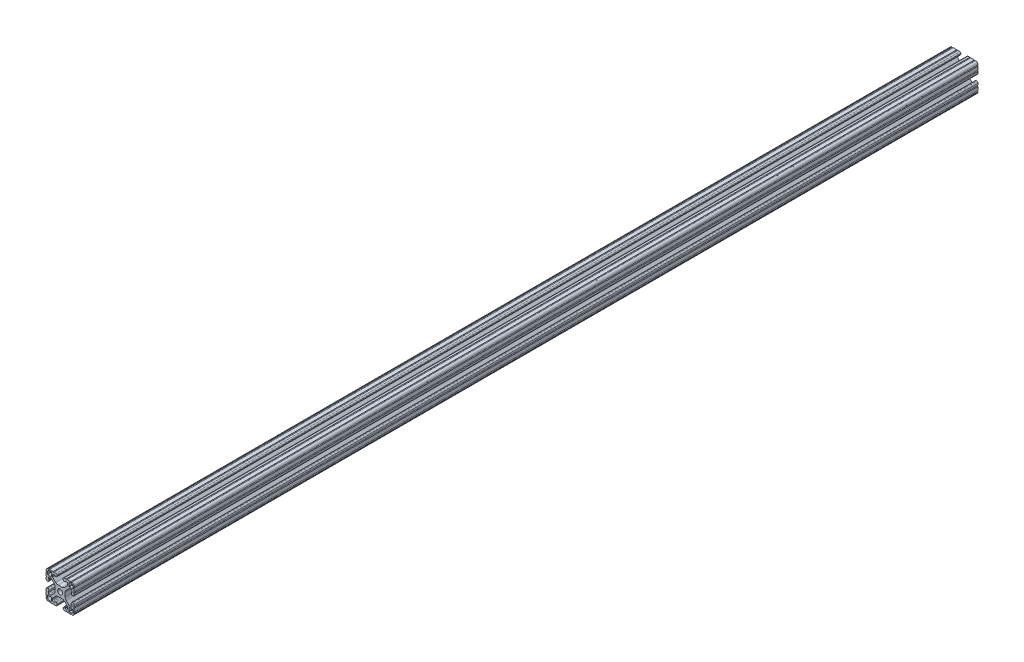
from build123d import *

# Parameters (mm, degrees)
SKETCH1_R           = 3.3274
BOSS_EXTRUDE1_DEPTH = 609.6


with BuildPart() as part:
    # Sketch1 → Boss-Extrude1 (new, symmetric)
    with BuildSketch(Plane.XY):
        with BuildLine():
            Line((-10.02670034, 12.151875049), (-6.021451835, 8.147301292))
            ThreePointArc((-6.021451835, 8.147301292), (-4.48060392, 7.11788044), (-2.663118988, 6.7564))
            Line((-2.663118988, 6.7564), (2.663118988, 6.7564))
            ThreePointArc((2.663118988, 6.7564), (4.48060392, 7.11788044), (6.021451835, 8.147301292))
            Line((6.021451835, 8.147301292), (10.02670034, 12.151875049))
            ThreePointArc((10.02670034, 12.151875049), (10.219349756, 12.440155844), (10.287, 12.78021916))
            Line((10.287, 12.78021916), (10.287, 14.55471092))
            ThreePointArc((10.287, 14.55471092), (9.915025612, 15.452736532), (9.017, 15.82471092))
            Line((9.017, 15.82471092), (6.814144259, 15.82471092))
            Line((6.814144259, 15.82471092), (6.814144259, 14.986))
            Line((6.814144259, 14.986), (5.6388, 14.986))
            ThreePointArc((5.6388, 14.986), (4.525248241, 15.447248241), (4.064, 16.5608))
            Line((4.064, 16.5608), (4.064, 17.4752))
            ThreePointArc((4.064, 17.4752), (4.525248241, 18.588751759), (5.6388, 19.05))
            Line((5.6388, 19.05), (7.9756, 19.05))
            ThreePointArc((7.9756, 19.05), (8.7376, 18.288), (9.4996, 19.05))
            Line((9.4996, 19.05), (14.3256, 19.05))
            ThreePointArc((14.3256, 19.05), (15.0876, 18.288), (15.8496, 19.05))
            Line((15.8496, 19.05), (15.875, 19.05))
            ThreePointArc((15.875, 19.05), (18.12006403, 18.12006403), (19.05, 15.875))
            Line((19.05, 15.875), (19.05, 15.8496))
            ThreePointArc((19.05, 15.8496), (18.288, 15.0876), (19.05, 14.3256))
            Line((19.05, 14.3256), (19.05, 9.4996))
            ThreePointArc((19.05, 9.4996), (18.288, 8.7376), (19.05, 7.9756))
            Line((19.05, 7.9756), (19.05, 5.6388))
            ThreePointArc((19.05, 5.6388), (18.588751759, 4.525248241), (17.4752, 4.064))
            Line((17.4752, 4.064), (16.5608, 4.064))
            ThreePointArc((16.5608, 4.064), (15.447248241, 4.525248241), (14.986, 5.6388))
            Line((14.986, 5.6388), (14.986, 6.750644259))
            Line((14.986, 6.750644259), (15.879033733, 6.750644259))
            Line((15.879033733, 6.750644259), (15.879033733, 8.919211783))
            ThreePointArc((15.879033733, 8.919211783), (15.507059345, 9.817237395), (14.609033733, 10.189211783))
            Line((14.609033733, 10.189211783), (12.742784468, 10.189211783))
            ThreePointArc((12.742784468, 10.189211783), (12.402613491, 10.121555016), (12.114219497, 9.928882664))
            Line((12.114219497, 9.928882664), (8.147867153, 5.963198517))
            ThreePointArc((8.147867153, 5.963198517), (7.118033561, 4.422154408), (6.7564, 2.604299809))
            Line((6.7564, 2.604299809), (6.7564, -2.604299809))
            ThreePointArc((6.7564, -2.604299809), (7.118033561, -4.422154408), (8.147867153, -5.963198517))
            Line((8.147867153, -5.963198517), (12.114219497, -9.928882664))
            ThreePointArc((12.114219497, -9.928882664), (12.402613491, -10.121555016), (12.742784468, -10.189211783))
            Line((12.742784468, -10.189211783), (14.609033733, -10.189211783))
            ThreePointArc((14.609033733, -10.189211783), (15.507059345, -9.817237395), (15.879033733, -8.919211783))
            Line((15.879033733, -8.919211783), (15.879033733, -6.750644259))
            Line((15.879033733, -6.750644259), (14.986, -6.750644259))
            Line((14.986, -6.750644259), (14.986, -5.6388))
            ThreePointArc((14.986, -5.6388), (15.447248241, -4.525248241), (16.5608, -4.064))
            Line((16.5608, -4.064), (17.4752, -4.064))
            ThreePointArc((17.4752, -4.064), (18.588751759, -4.525248241), (19.05, -5.6388))
            Line((19.05, -5.6388), (19.05, -7.9756))
            ThreePointArc((19.05, -7.9756), (18.288, -8.7376), (19.05, -9.4996))
            Line((19.05, -9.4996), (19.05, -14.3256))
            ThreePointArc((19.05, -14.3256), (18.288, -15.0876), (19.05, -15.8496))
            Line((19.05, -15.8496), (19.05, -15.875))
            ThreePointArc((19.05, -15.875), (18.12006403, -18.12006403), (15.875, -19.05))
            Line((15.875, -19.05), (15.8496, -19.05))
            ThreePointArc((15.8496, -19.05), (15.0876, -18.288), (14.3256, -19.05))
            Line((14.3256, -19.05), (9.4996, -19.05))
            ThreePointArc((9.4996, -19.05), (8.7376, -18.288), (7.9756, -19.05))
            Line((7.9756, -19.05), (5.6388, -19.05))
            ThreePointArc((5.6388, -19.05), (4.525248241, -18.588751759), (4.064, -17.4752))
            Line((4.064, -17.4752), (4.064, -16.5608))
            ThreePointArc((4.064, -16.5608), (4.525248241, -15.447248241), (5.6388, -14.986))
            Line((5.6388, -14.986), (6.814144259, -14.986))
            Line((6.814144259, -14.986), (6.814144259, -15.82471092))
            Line((6.814144259, -15.82471092), (9.017, -15.82471092))
            ThreePointArc((9.017, -15.82471092), (9.915025612, -15.452736532), (10.287, -14.55471092))
            Line((10.287, -14.55471092), (10.287, -12.78021916))
            ThreePointArc((10.287, -12.78021916), (10.219349756, -12.440155844), (10.02670034, -12.151875049))
            Line((10.02670034, -12.151875049), (6.021451835, -8.147301292))
            ThreePointArc((6.021451835, -8.147301292), (4.48060392, -7.11788044), (2.663118988, -6.7564))
            Line((2.663118988, -6.7564), (-2.663118988, -6.7564))
            ThreePointArc((-2.663118988, -6.7564), (-4.48060392, -7.11788044), (-6.021451835, -8.147301292))
            Line((-6.021451835, -8.147301292), (-10.02670034, -12.151875049))
            ThreePointArc((-10.02670034, -12.151875049), (-10.219349756, -12.440155844), (-10.287, -12.78021916))
            Line((-10.287, -12.78021916), (-10.287, -14.55471092))
            ThreePointArc((-10.287, -14.55471092), (-9.915025612, -15.452736532), (-9.017, -15.82471092))
            Line((-9.017, -15.82471092), (-6.814144259, -15.82471092))
            Line((-6.814144259, -15.82471092), (-6.814144259, -14.986))
            Line((-6.814144259, -14.986), (-5.6388, -14.986))
            ThreePointArc((-5.6388, -14.986), (-4.525248241, -15.447248241), (-4.064, -16.5608))
            Line((-4.064, -16.5608), (-4.064, -17.4752))
            ThreePointArc((-4.064, -17.4752), (-4.525248241, -18.588751759), (-5.6388, -19.05))
            Line((-5.6388, -19.05), (-7.9756, -19.05))
            ThreePointArc((-7.9756, -19.05), (-8.7376, -18.288), (-9.4996, -19.05))
            Line((-9.4996, -19.05), (-14.3256, -19.05))
            ThreePointArc((-14.3256, -19.05), (-15.0876, -18.288), (-15.8496, -19.05))
            Line((-15.8496, -19.05), (-15.875, -19.05))
            ThreePointArc((-15.875, -19.05), (-18.12006403, -18.12006403), (-19.05, -15.875))
            Line((-19.05, -15.875), (-19.05, -15.8496))
            ThreePointArc((-19.05, -15.8496), (-18.288, -15.0876), (-19.05, -14.3256))
            Line((-19.05, -14.3256), (-19.05, -9.4996))
            ThreePointArc((-19.05, -9.4996), (-18.288, -8.7376), (-19.05, -7.9756))
            Line((-19.05, -7.9756), (-19.05, -5.6388))
            ThreePointArc((-19.05, -5.6388), (-18.588751759, -4.525248241), (-17.4752, -4.064))
            Line((-17.4752, -4.064), (-16.5608, -4.064))
            ThreePointArc((-16.5608, -4.064), (-15.447248241, -4.525248241), (-14.986, -5.6388))
            Line((-14.986, -5.6388), (-14.986, -6.750644259))
            Line((-14.986, -6.750644259), (-15.879033733, -6.750644259))
            Line((-15.879033733, -6.750644259), (-15.879033733, -8.919211783))
            ThreePointArc((-15.879033733, -8.919211783), (-15.507059345, -9.817237395), (-14.609033733, -10.189211783))
            Line((-14.609033733, -10.189211783), (-12.742784468, -10.189211783))
            ThreePointArc((-12.742784468, -10.189211783), (-12.402613491, -10.121555016), (-12.114219497, -9.928882664))
            Line((-12.114219497, -9.928882664), (-8.147867153, -5.963198517))
            ThreePointArc((-8.147867153, -5.963198517), (-7.118033561, -4.422154408), (-6.7564, -2.604299809))
            Line((-6.7564, -2.604299809), (-6.7564, 2.604299809))
            ThreePointArc((-6.7564, 2.604299809), (-7.118033561, 4.422154408), (-8.147867153, 5.963198517))
            Line((-8.147867153, 5.963198517), (-12.114219497, 9.928882664))
            ThreePointArc((-12.114219497, 9.928882664), (-12.402613491, 10.121555016), (-12.742784468, 10.189211783))
            Line((-12.742784468, 10.189211783), (-14.609033733, 10.189211783))
            ThreePointArc((-14.609033733, 10.189211783), (-15.507059345, 9.817237395), (-15.879033733, 8.919211783))
            Line((-15.879033733, 8.919211783), (-15.879033733, 6.750644259))
            Line((-15.879033733, 6.750644259), (-14.986, 6.750644259))
            Line((-14.986, 6.750644259), (-14.986, 5.6388))
            ThreePointArc((-14.986, 5.6388), (-15.447248241, 4.525248241), (-16.5608, 4.064))
            Line((-16.5608, 4.064), (-17.4752, 4.064))
            ThreePointArc((-17.4752, 4.064), (-18.588751759, 4.525248241), (-19.05, 5.6388))
            Line((-19.05, 5.6388), (-19.05, 7.9756))
            ThreePointArc((-19.05, 7.9756), (-18.288, 8.7376), (-19.05, 9.4996))
            Line((-19.05, 9.4996), (-19.05, 14.3256))
            ThreePointArc((-19.05, 14.3256), (-18.288, 15.0876), (-19.05, 15.8496))
            Line((-19.05, 15.8496), (-19.05, 15.875))
            ThreePointArc((-19.05, 15.875), (-18.12006403, 18.12006403), (-15.875, 19.05))
            Line((-15.875, 19.05), (-15.8496, 19.05))
            ThreePointArc((-15.8496, 19.05), (-15.0876, 18.288), (-14.3256, 19.05))
            Line((-14.3256, 19.05), (-9.4996, 19.05))
            ThreePointArc((-9.4996, 19.05), (-8.7376, 18.288), (-7.9756, 19.05))
            Line((-7.9756, 19.05), (-5.6388, 19.05))
            ThreePointArc((-5.6388, 19.05), (-4.525248241, 18.588751759), (-4.064, 17.4752))
            Line((-4.064, 17.4752), (-4.064, 16.5608))
            ThreePointArc((-4.064, 16.5608), (-4.525248241, 15.447248241), (-5.6388, 14.986))
            Line((-5.6388, 14.986), (-6.814144259, 14.986))
            Line((-6.814144259, 14.986), (-6.814144259, 15.82471092))
            Line((-6.814144259, 15.82471092), (-9.017, 15.82471092))
            ThreePointArc((-9.017, 15.82471092), (-9.915025612, 15.452736532), (-10.287, 14.55471092))
            Line((-10.287, 14.55471092), (-10.287, 12.78021916))
            ThreePointArc((-10.287, 12.78021916), (-10.219349756, 12.440155844), (-10.02670034, 12.151875049))
        make_face()
        with Locations(Location((0, 0, 0), (0, 0, 180))):
            Circle(SKETCH1_R, mode=Mode.SUBTRACT)
        with BuildLine():
            Line((-16.891, 11.8618), (-12.2428, 11.8618))
            ThreePointArc((-12.2428, 11.8618), (-11.973392316, 11.973392316), (-11.8618, 12.2428))
            Line((-11.8618, 12.2428), (-11.8618, 16.891))
            ThreePointArc((-11.8618, 16.891), (-11.973392316, 17.160407684), (-12.2428, 17.272))
            Line((-12.2428, 17.272), (-14.478, 17.272))
            ThreePointArc((-14.478, 17.272), (-16.453656347, 16.453656347), (-17.272, 14.478))
            Line((-17.272, 14.478), (-17.272, 12.2428))
            ThreePointArc((-17.272, 12.2428), (-17.160407684, 11.973392316), (-16.891, 11.8618))
        make_face(mode=Mode.SUBTRACT)
        with BuildLine():
            Line((-17.272, -14.478), (-17.272, -12.2428))
            ThreePointArc((-17.272, -12.2428), (-17.160407684, -11.973392316), (-16.891, -11.8618))
            Line((-16.891, -11.8618), (-12.2428, -11.8618))
            ThreePointArc((-12.2428, -11.8618), (-11.973392316, -11.973392316), (-11.8618, -12.2428))
            Line((-11.8618, -12.2428), (-11.8618, -16.891))
            ThreePointArc((-11.8618, -16.891), (-11.973392316, -17.160407684), (-12.2428, -17.272))
            Line((-12.2428, -17.272), (-14.478, -17.272))
            ThreePointArc((-14.478, -17.272), (-16.453656347, -16.453656347), (-17.272, -14.478))
        make_face(mode=Mode.SUBTRACT)
        with BuildLine():
            Line((17.272, 14.478), (17.272, 12.2428))
            ThreePointArc((17.272, 12.2428), (17.160407684, 11.973392316), (16.891, 11.8618))
            Line((16.891, 11.8618), (12.2428, 11.8618))
            ThreePointArc((12.2428, 11.8618), (11.973392316, 11.973392316), (11.8618, 12.2428))
            Line((11.8618, 12.2428), (11.8618, 16.891))
            ThreePointArc((11.8618, 16.891), (11.973392316, 17.160407684), (12.2428, 17.272))
            Line((12.2428, 17.272), (14.478, 17.272))
            ThreePointArc((14.478, 17.272), (16.453656347, 16.453656347), (17.272, 14.478))
        make_face(mode=Mode.SUBTRACT)
        with BuildLine():
            Line((16.891, -11.8618), (12.2428, -11.8618))
            ThreePointArc((12.2428, -11.8618), (11.973392316, -11.973392316), (11.8618, -12.2428))
            Line((11.8618, -12.2428), (11.8618, -16.891))
            ThreePointArc((11.8618, -16.891), (11.973392316, -17.160407684), (12.2428, -17.272))
            Line((12.2428, -17.272), (14.478, -17.272))
            ThreePointArc((14.478, -17.272), (16.453656347, -16.453656347), (17.272, -14.478))
            Line((17.272, -14.478), (17.272, -12.2428))
            ThreePointArc((17.272, -12.2428), (17.160407684, -11.973392316), (16.891, -11.8618))
        make_face(mode=Mode.SUBTRACT)
    extrude(amount=BOSS_EXTRUDE1_DEPTH, both=True)


solid = part.part
